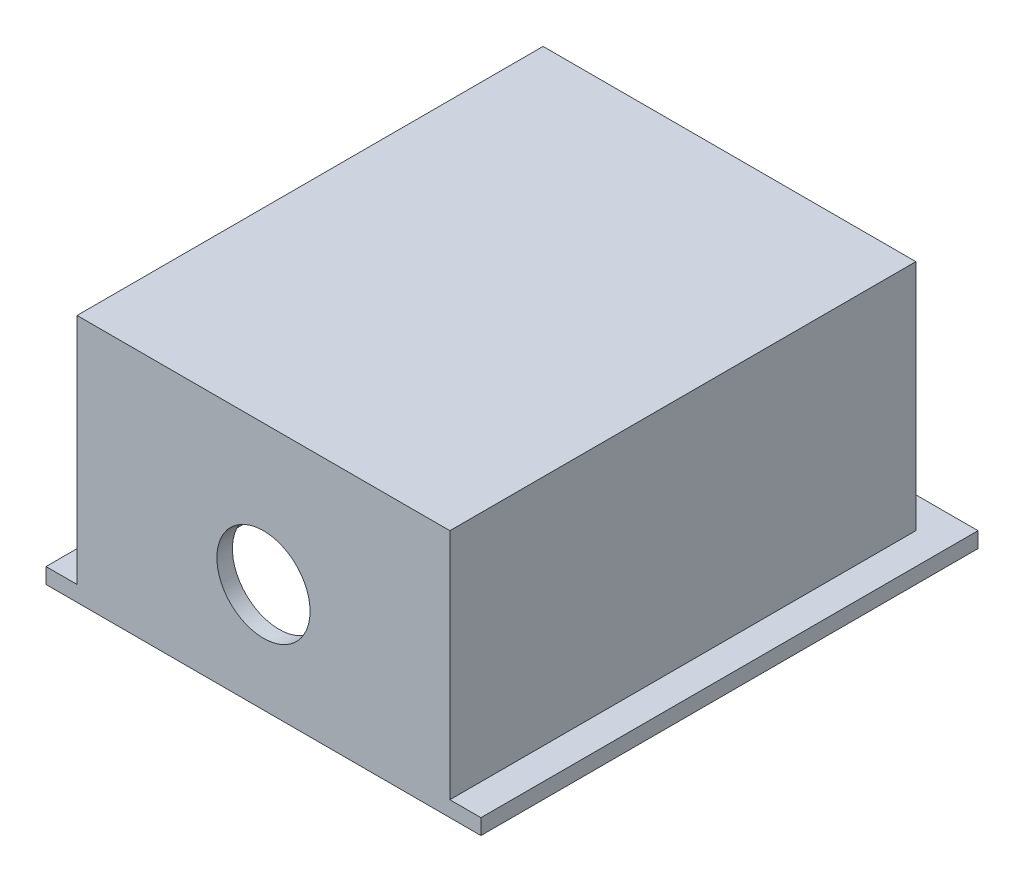
from build123d import *

# Parameters (mm, degrees)
SKETCH_1_W          = 120
SKETCH_1_H          = 80
EXTRUDE_1_DEPTH     = 150
SHELL_1_T           = -5
EXTRUDE_2_DEPTH     = 5
SKETCH_3_R          = 15
CUT_EXTRUDE_1_DEPTH = 10000


with BuildPart() as part:
    # 草图1 → 凸台-拉伸1 (new body)
    with BuildSketch(Plane.XY):
        Rectangle(SKETCH_1_W, SKETCH_1_H)
    extrude(amount=EXTRUDE_1_DEPTH)

    # 抽壳1
    shell_1_openings = [part.faces().sort_by_distance(p)[0] for p in [
        (0, -40, 75),
    ]]
    offset(amount=SHELL_1_T, openings=shell_1_openings, kind=Kind.INTERSECTION)

    # 草图2 → 凸台-拉伸2 (add)
    with BuildSketch(Plane.XZ.offset(40)):
        Polygon((-60, 150), (-70, 150), (-70, -10), (70, -10), (70, 150), (60, 150), (60, 0), (-60, 0), align=None)
    extrude(amount=-EXTRUDE_2_DEPTH)

    # 草图3 → 切除-拉伸1 (cut)
    with BuildSketch(Plane(origin=(0, 0, 0), x_dir=(-1, 0, 0), z_dir=(0, 0, -1))):
        with Locations((0, -5)):
            Circle(SKETCH_3_R)
    extrude(amount=-CUT_EXTRUDE_1_DEPTH, mode=Mode.SUBTRACT)


solid = part.part
